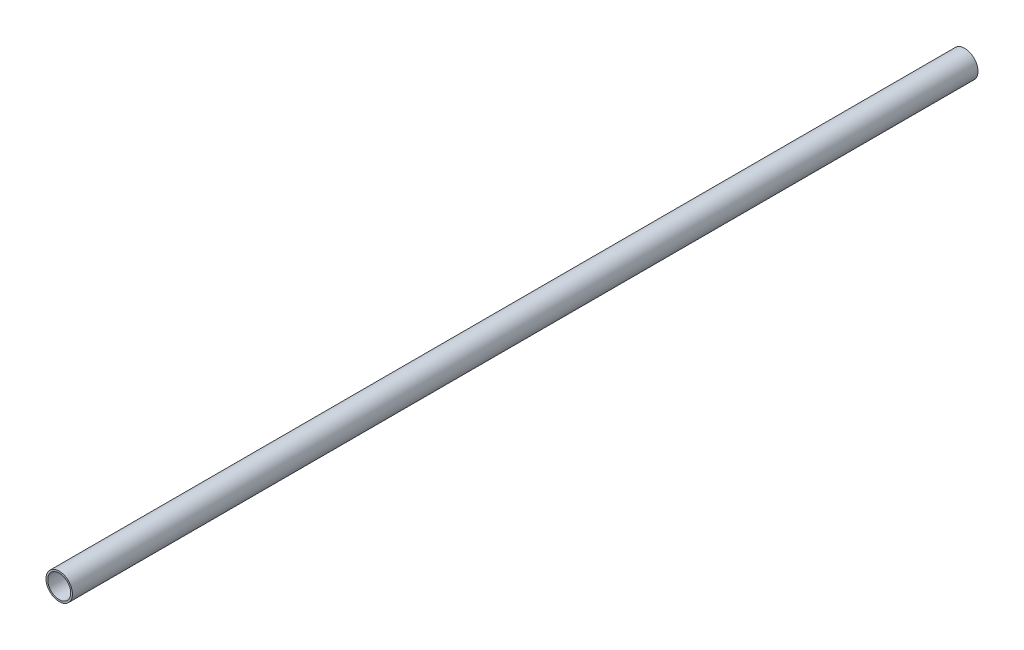
from build123d import *

# Parameters (mm, degrees)
SKETCH1_R           = 11.1125
SKETCH1_R_2         = 9.6395
BOSS_EXTRUDE1_DEPTH = 760


with BuildPart() as part:
    # Sketch1 → Boss-Extrude1 (new body)
    with BuildSketch(Plane.XY):
        Circle(SKETCH1_R)
        Circle(SKETCH1_R_2, mode=Mode.SUBTRACT)
    extrude(amount=BOSS_EXTRUDE1_DEPTH)


solid = part.part
